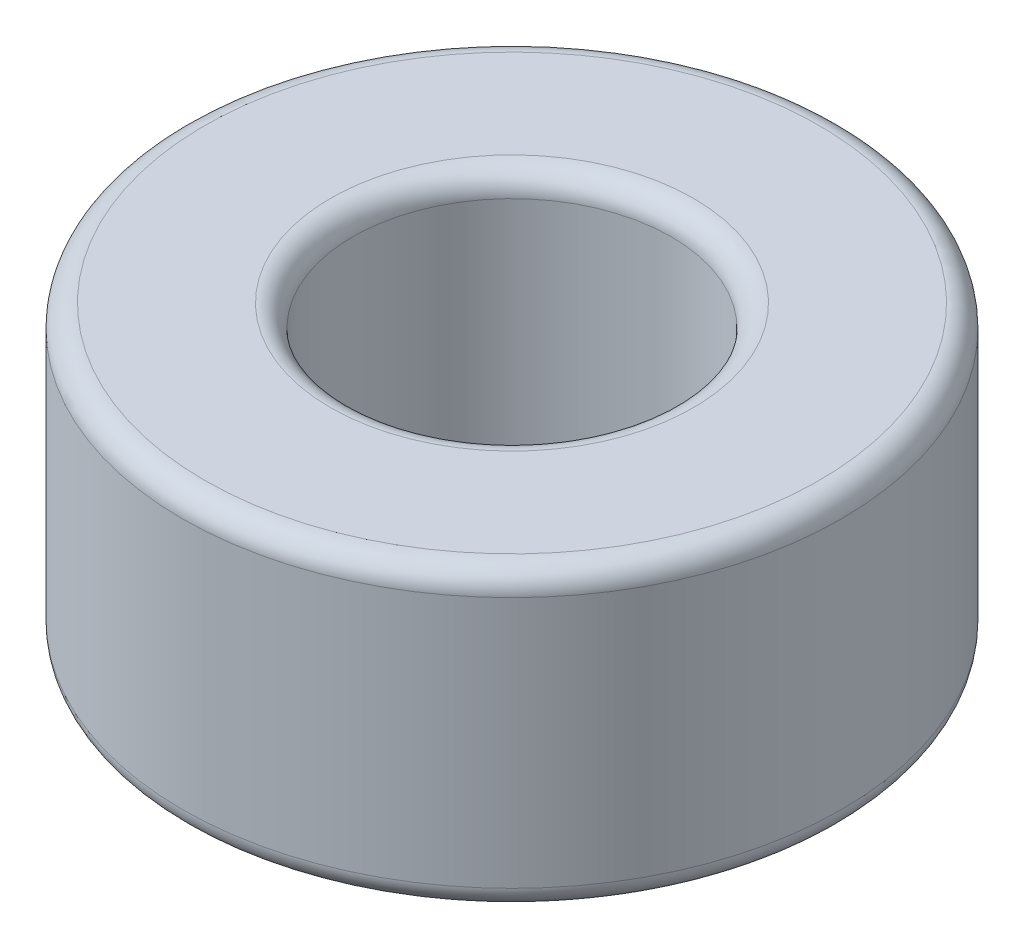
from build123d import *

# Parameters (mm, degrees)
SKETCH_1_R      = 4.45
SKETCH_1_R_2    = 2.15
EXTRUDE_1_DEPTH = 4
FILLET_1_R      = 0.3


with BuildPart() as part:
    # Эскиз1 → Бобышка-Вытянуть1 (new body)
    with BuildSketch(Plane(origin=(0, 0, 0), x_dir=(1, 0, 0), z_dir=(0, 1, 0))):
        with Locations(Location((0, 0, 0), (0, 0, 270))):
            Circle(SKETCH_1_R)
        with Locations(Location((0, 0, 0), (0, 0, 270))):
            Circle(SKETCH_1_R_2, mode=Mode.SUBTRACT)
    extrude(amount=EXTRUDE_1_DEPTH)

    # Скругление1
    fillet_1_edges = [part.edges().sort_by_distance(p)[0] for p in [
        (0, 0, -4.45),
        (0, 4, -4.45),
        (0, 0, -2.15),
        (0, 4, -2.15),
    ]]
    fillet(fillet_1_edges, radius=FILLET_1_R)


solid = part.part
